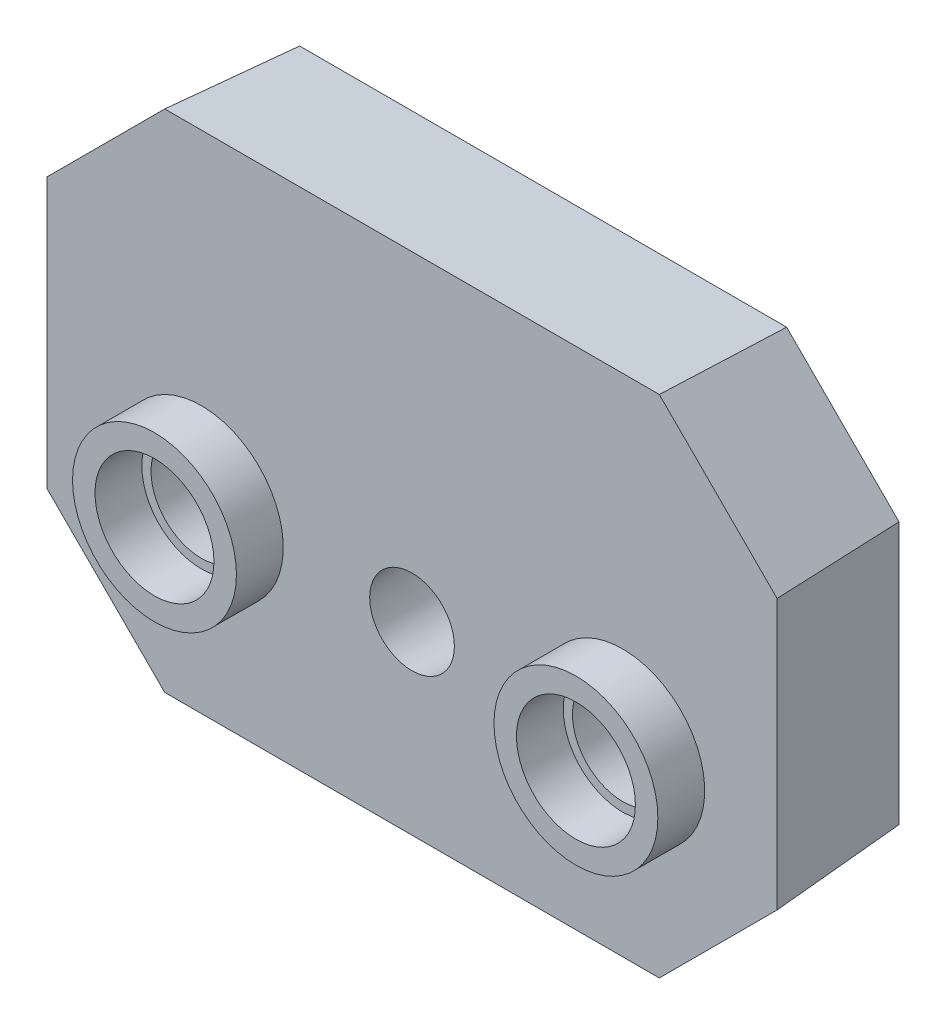
from build123d import *

# Parameters (mm, degrees)
SKETCH1_R           = 12.7
SKETCH1_R_2         = 11
BOSS_EXTRUDE1_DEPTH = 28
BOSS_EXTRUDE1_DRAFT = -4
SKETCH2_R           = 17.5
SKETCH2_R_2         = 12.7
BOSS_EXTRUDE2_DEPTH = 38


with BuildPart() as part:
    # Sketch1 → Boss-Extrude1 (with draft: the straight prism first)
    with BuildSketch(Plane.XY):
        Polygon((-52, 52), (-76, 28), (-76, -28), (-52, -52), (52, -52), (76, -28), (76, 28), (52, 52), align=None)
        with Locations((-45, -14.5)):
            Circle(SKETCH1_R, mode=Mode.SUBTRACT)
        with Locations((45, -14.5)):
            Circle(SKETCH1_R, mode=Mode.SUBTRACT)
        with Locations((0, -14.5)):
            Circle(SKETCH1_R_2, mode=Mode.SUBTRACT)
    extrude(amount=BOSS_EXTRUDE1_DEPTH)
    # Boss-Extrude1: the draft: its side faces are tilted about the plane it starts from
    boss_extrude1_sides = [part.faces().sort_by_distance(p)[0] for p in [
        (-64, 40, 14),
        (-76, 0, 14),
        (-64, -40, 14),
        (0, -52, 14),
        (64, -40, 14),
        (76, 0, 14),
        (64, 40, 14),
        (0, 52, 14),
        (-57.7, -14.5, 14),
        (32.3, -14.5, 14),
        (-11, -14.5, 14),
    ]]
    draft(boss_extrude1_sides, Plane.XY, BOSS_EXTRUDE1_DRAFT)

    # Sketch2 → Boss-Extrude2 (add)
    # profile 1 of 2: a face of its own
    with BuildSketch(Plane.XY):
        with Locations(Location((-45, -14.5, 0), (0, 0, 180))):
            Circle(SKETCH2_R)
        with Locations(Location((-45, -14.5, 0), (0, 0, 180))):
            Circle(SKETCH2_R_2, mode=Mode.SUBTRACT)
    # profile 2 of 2: a face of its own
    with BuildSketch(Plane.XY):
        with Locations(Location((45, -14.5, 0), (0, 0, 180))):
            Circle(SKETCH2_R)
        with Locations(Location((45, -14.5, 0), (0, 0, 180))):
            Circle(SKETCH2_R_2, mode=Mode.SUBTRACT)
    extrude(amount=BOSS_EXTRUDE2_DEPTH)


solid = part.part
